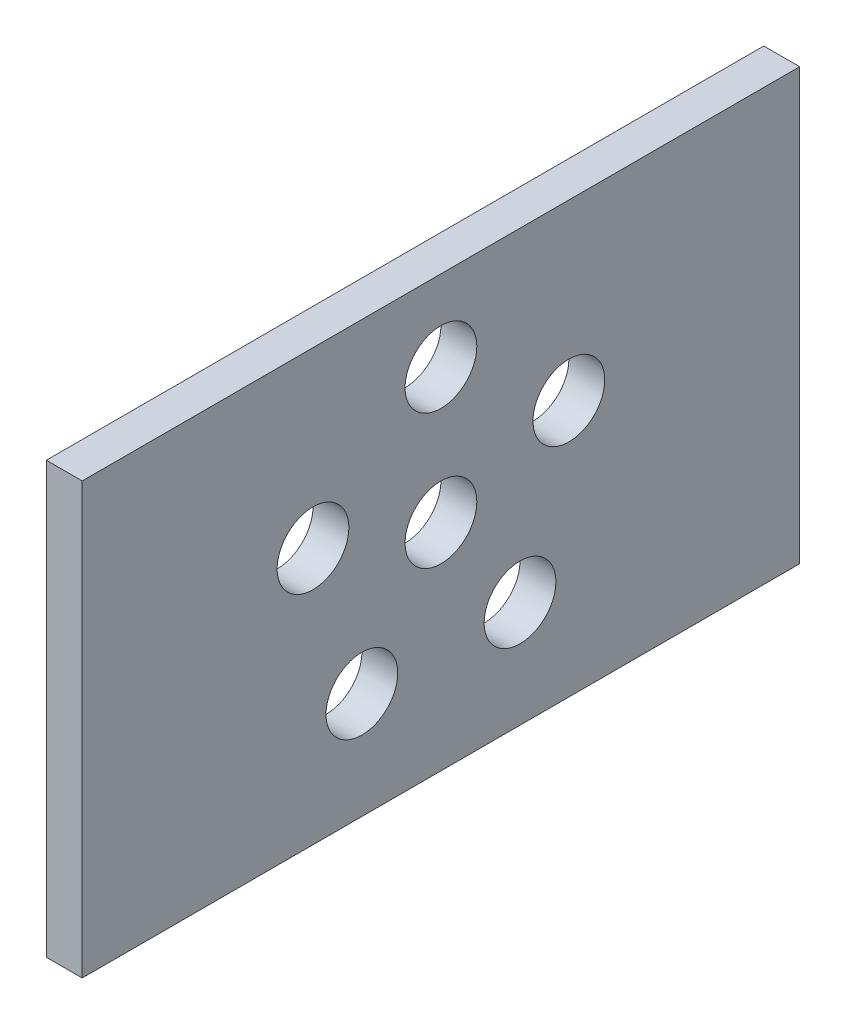
from build123d import *

# Parameters (mm, degrees)
SKETCH1_W           = 63.5
SKETCH1_H           = 38.1
SKETCH1_R           = 3.175
BOSS_EXTRUDE1_DEPTH = 3.175
SKETCH2_R           = 3.175
CUT_EXTRUDE1_DEPTH  = 38.162422217
CIRPATTERN1_COUNT   = 5


with BuildPart() as part:
    # Sketch1 → Boss-Extrude1 (new body)
    with BuildSketch(Plane(origin=(0, 0, 0), x_dir=(0, 0, -1), z_dir=(1, 0, 0))):
        Rectangle(SKETCH1_W, SKETCH1_H)
        Circle(SKETCH1_R, mode=Mode.SUBTRACT)
    extrude(amount=BOSS_EXTRUDE1_DEPTH)

    # Sketch2 → Cut-Extrude1 (cut, through all)
    with BuildSketch(Plane(origin=(0, 0, 0), x_dir=(0, 0, -1), z_dir=(1, 0, 0))):
        with Locations((0, 11.90625)):
            Circle(SKETCH2_R)
    cut_extrude1 = extrude(amount=CUT_EXTRUDE1_DEPTH, mode=Mode.SUBTRACT)

    # CirPattern1: Cut-Extrude1 ×5 about axis
    cirpattern1_axis = Axis((0, 0, 0), (1, 0, 0))
    for i in range(1, CIRPATTERN1_COUNT):
        add(cut_extrude1.rotate(cirpattern1_axis, i * 360 / CIRPATTERN1_COUNT), mode=Mode.SUBTRACT)


solid = part.part
